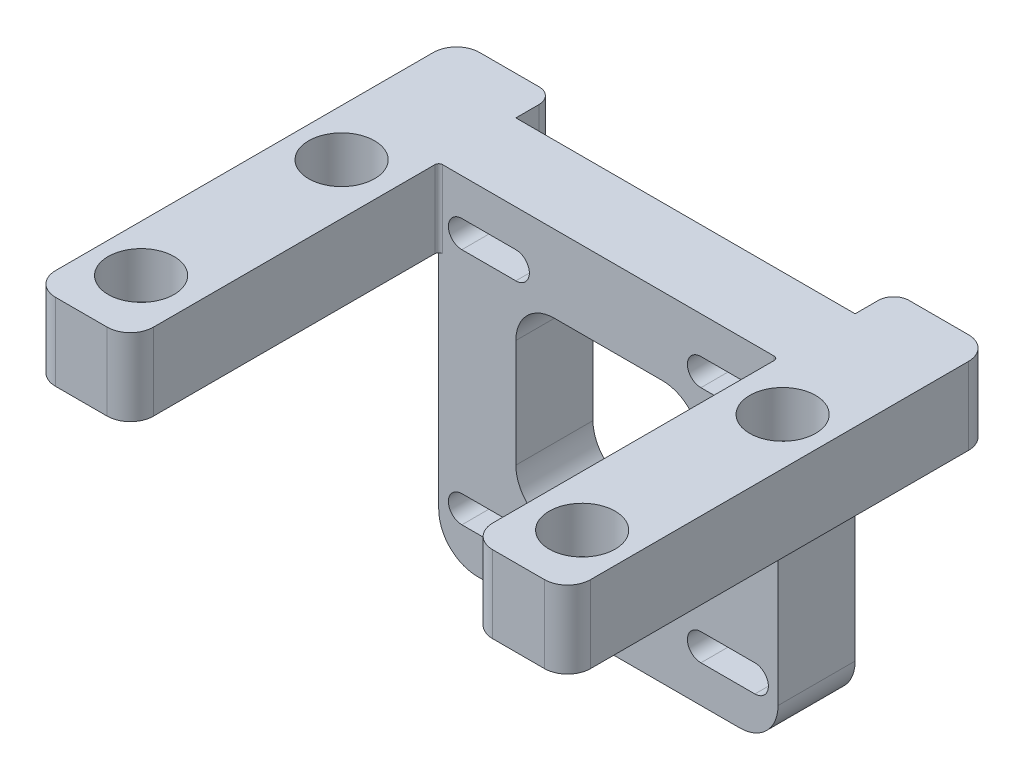
from build123d import *

# Parameters (mm, degrees)
SKETCH1_W           = 44
SKETCH1_H           = 44
BOSS_EXTRUDE1_DEPTH = 10
BOSS_EXTRUDE2_DEPTH = 12.7
SKETCH3_R           = 2.6
CUT_EXTRUDE1_DEPTH  = 70.714345726
SKETCH4_R           = 4.275
CUT_EXTRUDE2_DEPTH  = 72.750191637
FILLET1_R           = 3
FILLET2_R           = 5
FILLET3_R           = 0.5
FILLET4_R           = 2


with BuildPart() as part:
    # Sketch1 → Boss-Extrude1 (new body)
    with BuildSketch(Plane.XY):
        Rectangle(SKETCH1_W, SKETCH1_H)
        with BuildLine():
            Line((7, 12), (-7, 12))
            ThreePointArc((-7, 12), (-10.535533906, 10.535533906), (-12, 7))
            Line((-12, 7), (-12, -7))
            ThreePointArc((-12, -7), (-10.535533906, -10.535533906), (-7, -12))
            Line((-7, -12), (7, -12))
            ThreePointArc((7, -12), (10.535533906, -10.535533906), (12, -7))
            Line((12, -7), (12, 7))
            ThreePointArc((12, 7), (10.535533906, 10.535533906), (7, 12))
        make_face(mode=Mode.SUBTRACT)
        with BuildLine():
            Line((-19, 17.2), (-12, 17.2))
            ThreePointArc((-12, 17.2), (-10.25, 15.45), (-12, 13.7))
            Line((-12, 13.7), (-19, 13.7))
            ThreePointArc((-19, 13.7), (-20.75, 15.45), (-19, 17.2))
        make_face(mode=Mode.SUBTRACT)
        with BuildLine():
            Line((-19, -17.2), (-12, -17.2))
            ThreePointArc((-12, -17.2), (-10.25, -15.45), (-12, -13.7))
            Line((-12, -13.7), (-19, -13.7))
            ThreePointArc((-19, -13.7), (-20.75, -15.45), (-19, -17.2))
        make_face(mode=Mode.SUBTRACT)
        with BuildLine():
            Line((12, 17.2), (19, 17.2))
            ThreePointArc((19, 17.2), (20.75, 15.45), (19, 13.7))
            Line((19, 13.7), (12, 13.7))
            ThreePointArc((12, 13.7), (10.25, 15.45), (12, 17.2))
        make_face(mode=Mode.SUBTRACT)
        with BuildLine():
            Line((12, -13.7), (19, -13.7))
            ThreePointArc((19, -13.7), (20.75, -15.45), (19, -17.2))
            Line((19, -17.2), (12, -17.2))
            ThreePointArc((12, -17.2), (10.25, -15.45), (12, -13.7))
        make_face(mode=Mode.SUBTRACT)
    extrude(amount=BOSS_EXTRUDE1_DEPTH)

    # Sketch2 → Boss-Extrude2 (add)
    with BuildSketch(Plane(origin=(22, 0, 0), x_dir=(0, 0, -1), z_dir=(1, 0, 0))):
        Polygon((5, 12), (-50, 12), (-50, 16), (-50, 22), (5, 22), align=None)
    boss_extrude2 = extrude(amount=BOSS_EXTRUDE2_DEPTH)

    # Sketch3 → Cut-Extrude1 (cut, through all)
    with BuildSketch(Plane.XZ.offset(-12)):
        with Locations((28.6, 42)):
            Circle(SKETCH3_R)
        with Locations((28.6, 16)):
            Circle(SKETCH3_R)
    cut_extrude1 = extrude(amount=-CUT_EXTRUDE1_DEPTH, mode=Mode.SUBTRACT)

    # Sketch4 → Cut-Extrude2 (cut, through all)
    with BuildSketch(Plane(origin=(0, 16, 0), x_dir=(-1, 0, 0), z_dir=(0, -1, 0))):
        with Locations(Location((-28.6, -16, 0), (0, 0, 180))):
            Circle(SKETCH4_R)
        with Locations(Location((-28.6, -42, 0), (0, 0, 180))):
            Circle(SKETCH4_R)
    cut_extrude2 = extrude(amount=-CUT_EXTRUDE2_DEPTH, mode=Mode.SUBTRACT)

    # Mirror1: Boss-Extrude2, Cut-Extrude1, Cut-Extrude2 across plane
    add(boss_extrude2.mirror(Plane(origin=(0, 0, 0), x_dir=(0, 0, 1), z_dir=(1, 0, 0))))
    add(cut_extrude1.mirror(Plane(origin=(0, 0, 0), x_dir=(0, 0, 1), z_dir=(1, 0, 0))), mode=Mode.SUBTRACT)
    add(cut_extrude2.mirror(Plane(origin=(0, 0, 0), x_dir=(0, 0, 1), z_dir=(1, 0, 0))), mode=Mode.SUBTRACT)

    # Fillet1
    fillet1_edges = [part.edges().sort_by_distance(p)[0] for p in [
        (34.7, 17, -5),
        (34.7, 17, 50),
        (-34.7, 17, -5),
        (-34.7, 17, 50),
        (-22, 17, 50),
        (22, 17, 50),
    ]]
    fillet(fillet1_edges, radius=FILLET1_R)

    # Fillet2
    fillet2_edges = [part.edges().sort_by_distance(p)[0] for p in [
        (22, -22, 5),
        (-22, -22, 5),
    ]]
    fillet(fillet2_edges, radius=FILLET2_R)

    # Fillet3
    fillet3_edges = [part.edges().sort_by_distance(p)[0] for p in [
        (-22, 17, 10),
        (22, 17, 10),
    ]]
    fillet(fillet3_edges, radius=FILLET3_R)

    # Fillet4
    fillet4_edges = [part.edges().sort_by_distance(p)[0] for p in [
        (-22, 17, -5),
        (22, 17, -5),
    ]]
    fillet(fillet4_edges, radius=FILLET4_R)


solid = part.part
